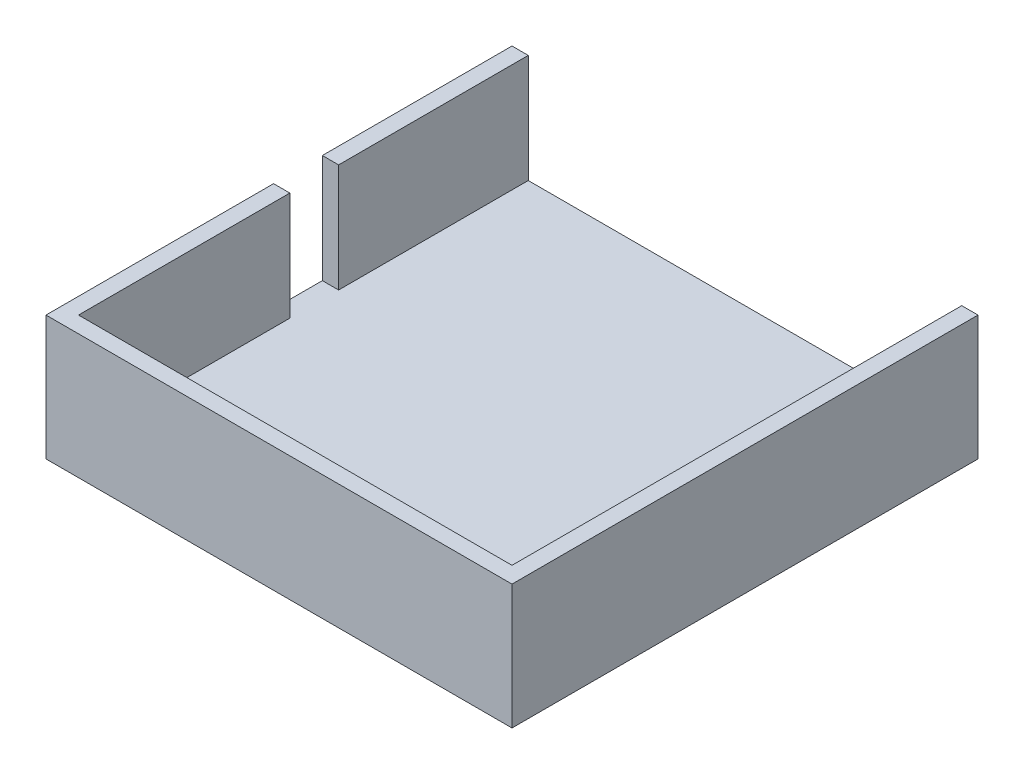
from build123d import *

# Parameters (mm, degrees)
SKETCH1_W           = 86
SKETCH1_H           = 86
BOSS_EXTRUDE1_DEPTH = 23
SHELL1_T            = -3
SKETCH2_W           = 9
SKETCH2_H           = 20
CUT_EXTRUDE1_DEPTH  = 3


with BuildPart() as part:
    # Sketch1 → Boss-Extrude1 (new body)
    with BuildSketch(Plane(origin=(0, 0, 0), x_dir=(1, 0, 0), z_dir=(0, 1, 0))):
        with Locations((-6.49444668, 4.080083427)):
            Rectangle(SKETCH1_W, SKETCH1_H)
    extrude(amount=BOSS_EXTRUDE1_DEPTH)

    # Shell1
    shell1_openings = [part.faces().sort_by_distance(p)[0] for p in [
        (-6.49444668, 23, -4.080083427),
        (-6.49444668, 11.5, -47.080083427),
    ]]
    offset(amount=SHELL1_T, openings=shell1_openings, kind=Kind.INTERSECTION)

    # Sketch2 → Cut-Extrude1 (cut)
    with BuildSketch(Plane.ZY.offset(49.49444668)):
        with Locations((-7.580083427, 13)):
            Rectangle(SKETCH2_W, SKETCH2_H)
    extrude(amount=-CUT_EXTRUDE1_DEPTH, mode=Mode.SUBTRACT)


solid = part.part
